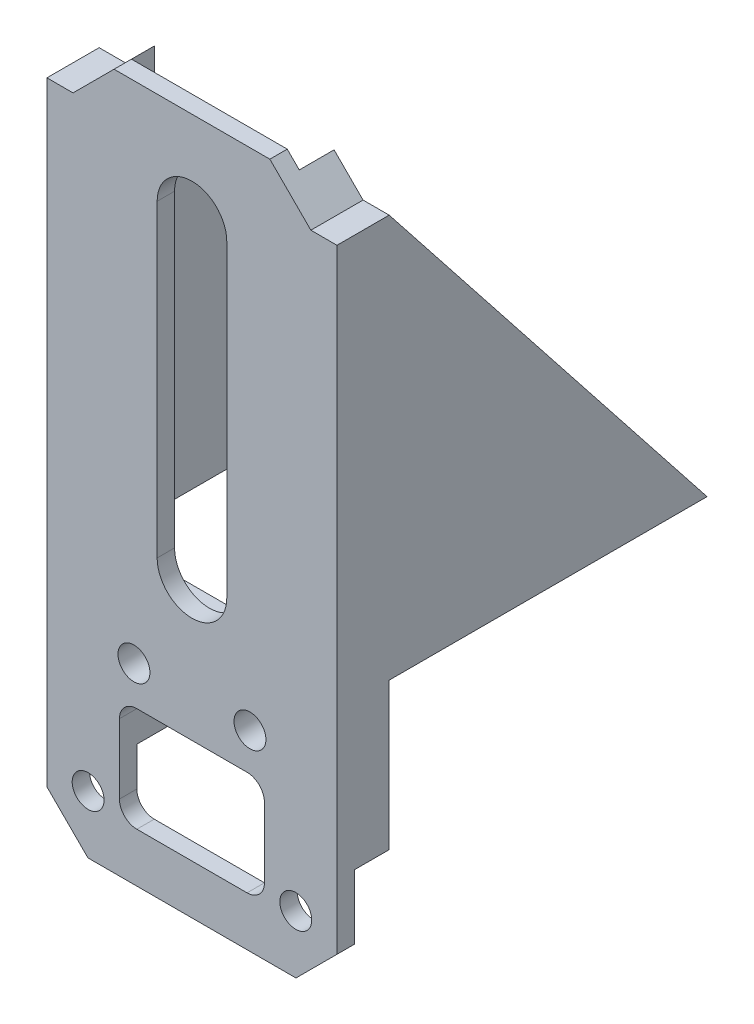
from build123d import *

# Parameters (mm, degrees)
SKETCH1_R           = 2.75
SKETCH1_W           = 25
SKETCH1_H           = 18
BOSS_EXTRUDE1_DEPTH = 3
CUT_EXTRUDE1_REACH  = 132.035
SKETCH3_R           = 2.75
SKETCH2_R           = 2.75
BOSS_EXTRUDE2_DEPTH = 6
FILLET1_R           = 3
BOSS_EXTRUDE5_DEPTH = 4.5
BOSS_EXTRUDE6_DEPTH = 4.5


with BuildPart() as part:
    # Sketch1 → Boss-Extrude1 (new body)
    with BuildSketch(Plane.XY):
        Polygon((7.071067812, 0), (42.928932188, 0), (50, 7.071067812), (50, 43.5), (45.5, 48), (45.5, 112.928932188), (38.428932188, 120), (11.571067812, 120), (4.5, 112.928932188), (4.5, 48), (0, 43.5), (0, 7.071067812), align=None)
        with Locations((7.1, 10)):
            Circle(SKETCH1_R, mode=Mode.SUBTRACT)
        with Locations(Location((42.9, 10, 0), (0, 0, 180))):
            Circle(SKETCH1_R, mode=Mode.SUBTRACT)
        with BuildLine():
            Line((19, 50.75), (19, 104))
            ThreePointArc((19, 104), (25, 110), (31, 104))
            Line((31, 104), (31, 50.75))
            ThreePointArc((31, 50.75), (25, 44.75), (19, 50.75))
        make_face(mode=Mode.SUBTRACT)
        with Locations((25, 17.5)):
            Rectangle(SKETCH1_W, SKETCH1_H, mode=Mode.SUBTRACT)
    extrude(amount=BOSS_EXTRUDE1_DEPTH)

    # Sketch3 → Cut-Extrude1 (cut, up to next)
    with BuildSketch(Plane.XY.offset(3), mode=Mode.PRIVATE) as cut_extrude1_sk1:
        with Locations((15, 33)):
            Circle(SKETCH3_R)
    cut_extrude1_tool1 = extrude(cut_extrude1_sk1.sketch, amount=-CUT_EXTRUDE1_REACH, mode=Mode.PRIVATE) & part.part
    # Sketch3 → Cut-Extrude1 (cut, up to next)
    with BuildSketch(Plane.XY.offset(3), mode=Mode.PRIVATE) as cut_extrude1_sk2:
        with Locations((35, 33)):
            Circle(SKETCH3_R)
    cut_extrude1_tool2 = extrude(cut_extrude1_sk2.sketch, amount=-CUT_EXTRUDE1_REACH, mode=Mode.PRIVATE) & part.part
    add(cut_extrude1_tool1.solids().sort_by_distance((15, 33, 3))[0], mode=Mode.SUBTRACT)
    add(cut_extrude1_tool2.solids().sort_by_distance((35, 33, 3))[0], mode=Mode.SUBTRACT)

    # Sketch2 → Boss-Extrude2 (add)
    with BuildSketch(Plane(origin=(0, 0, 0), x_dir=(-1, 0, 0), z_dir=(0, 0, -1))):
        Polygon((-50, 18.19), (-37.5, 18.19), (-37.5, 26.5), (-12.5, 26.5), (-12.5, 18.19), (0, 18.19), (0, 43.5), (-4.5, 48), (-4.5, 112.928932188), (-9.5, 117.928932188), (-9.5, 40.75), (-40.5, 40.75), (-40.5, 117.928932188), (-45.5, 112.928932188), (-45.5, 48), (-50, 43.5), align=None)
        with Locations(Location((-35, 33, 0), (0, 0, 180))):
            Circle(SKETCH2_R, mode=Mode.SUBTRACT)
        with Locations(Location((-15, 33, 0), (0, 0, 180))):
            Circle(SKETCH2_R, mode=Mode.SUBTRACT)
    extrude(amount=BOSS_EXTRUDE2_DEPTH)

    # Fillet1
    fillet1_edges = [part.edges().sort_by_distance(p)[0] for p in [
        (37.5, 8.5, 1.5),
        (37.5, 26.5, -3),
        (12.5, 26.5, -3),
        (12.5, 8.5, 1.5),
    ]]
    fillet(fillet1_edges, radius=FILLET1_R)

    # Sketch4 → Boss-Extrude5 (add)
    with BuildSketch(Plane(origin=(45.5, 0, 0), x_dir=(0, 0, -1), z_dir=(1, 0, 0))):
        Polygon((-3, 43.5), (60.8, 43.5), (6, 112.928932188), (-3, 112.928932188), align=None)
    extrude(amount=BOSS_EXTRUDE5_DEPTH)

    # Sketch7 → Boss-Extrude6 (add)
    with BuildSketch(Plane.ZY.offset(-4.5)):
        Polygon((3, 112.928932188), (3, 43.5), (-60.8, 43.5), (-6, 112.928932188), align=None)
    extrude(amount=BOSS_EXTRUDE6_DEPTH)


solid = part.part
